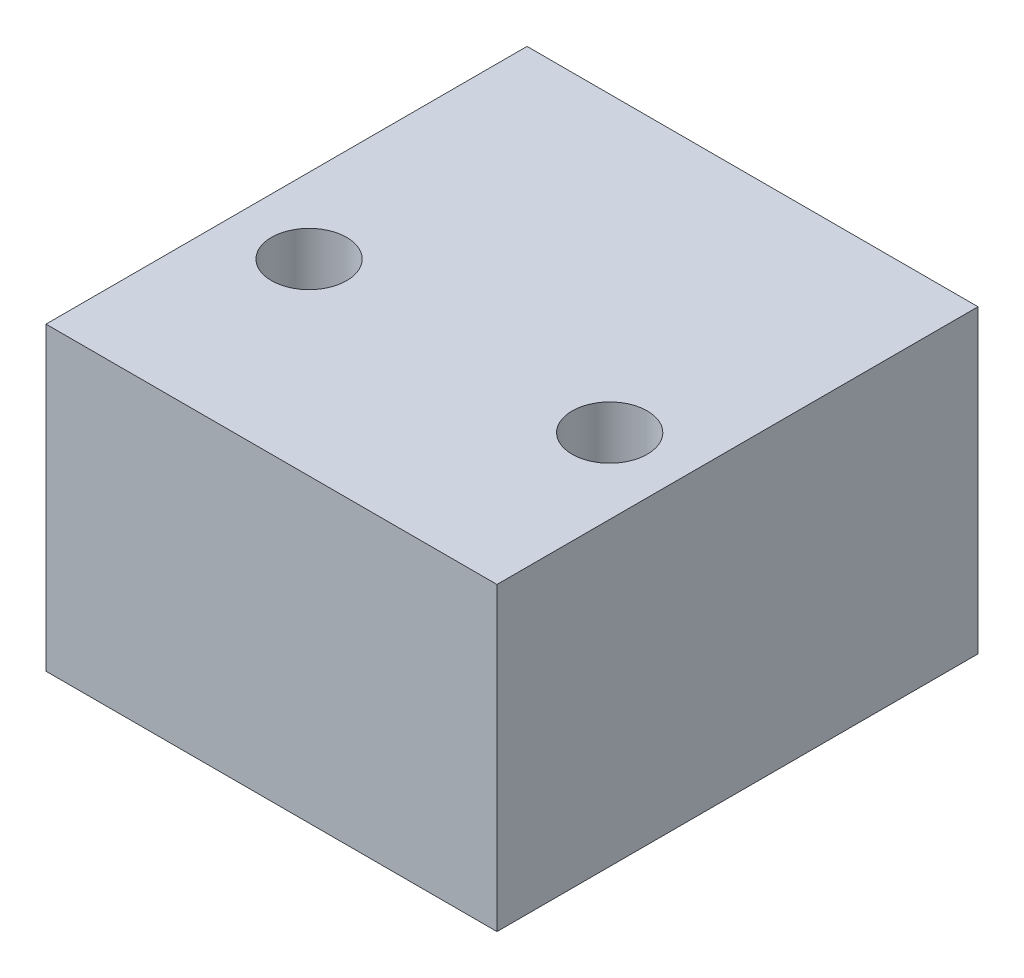
from build123d import *

# Parameters (mm, degrees)
SKETCH1_W           = 30
SKETCH1_H           = 22
SKETCH1_H_2         = 32
SKETCH1_R           = 2.5
BOSS_EXTRUDE1_DEPTH = 20


with BuildPart() as part:
    # Sketch1 → Boss-Extrude1 (new body)
    # profile 1 of 2: a face of its own
    with BuildSketch(Plane(origin=(0, 0, 0), x_dir=(1, 0, 0), z_dir=(0, 1, 0))):
        with Locations((0, 3.5)):
            Rectangle(SKETCH1_W, SKETCH1_H)
        with BuildLine():
            ThreePointArc((-7.5, -2.5), (-10, -5), (-12.5, -2.5))
            Line((-12.5, -2.5), (-12.5, 0))
            Line((-12.5, 0), (-12.5, 2.5))
            ThreePointArc((-12.5, 2.5), (-10, 5), (-7.5, 2.5))
            Line((-7.5, 2.5), (-7.5, 0))
            Line((-7.5, 0), (-7.5, -2.5))
        make_face(mode=Mode.SUBTRACT)
        with BuildLine():
            ThreePointArc((12.5, -2.5), (10, -5), (7.5, -2.5))
            Line((7.5, -2.5), (7.5, 0))
            Line((7.5, 0), (7.5, 2.5))
            ThreePointArc((7.5, 2.5), (10, 5), (12.5, 2.5))
            Line((12.5, 2.5), (12.5, 0))
            Line((12.5, 0), (12.5, -2.5))
        make_face(mode=Mode.SUBTRACT)
    # profile 2 of 2: a face of its own
    with BuildSketch(Plane(origin=(0, 0, 0), x_dir=(1, 0, 0), z_dir=(0, 1, 0))):
        with Locations((0, 3.5)):
            Rectangle(SKETCH1_W, SKETCH1_H_2)
        with Locations(Location((10, 0, 0), (0, 0, 270))):
            Circle(SKETCH1_R, mode=Mode.SUBTRACT)
        with Locations(Location((-10, 0, 0), (0, 0, 270))):
            Circle(SKETCH1_R, mode=Mode.SUBTRACT)
    extrude(amount=BOSS_EXTRUDE1_DEPTH)


solid = part.part
